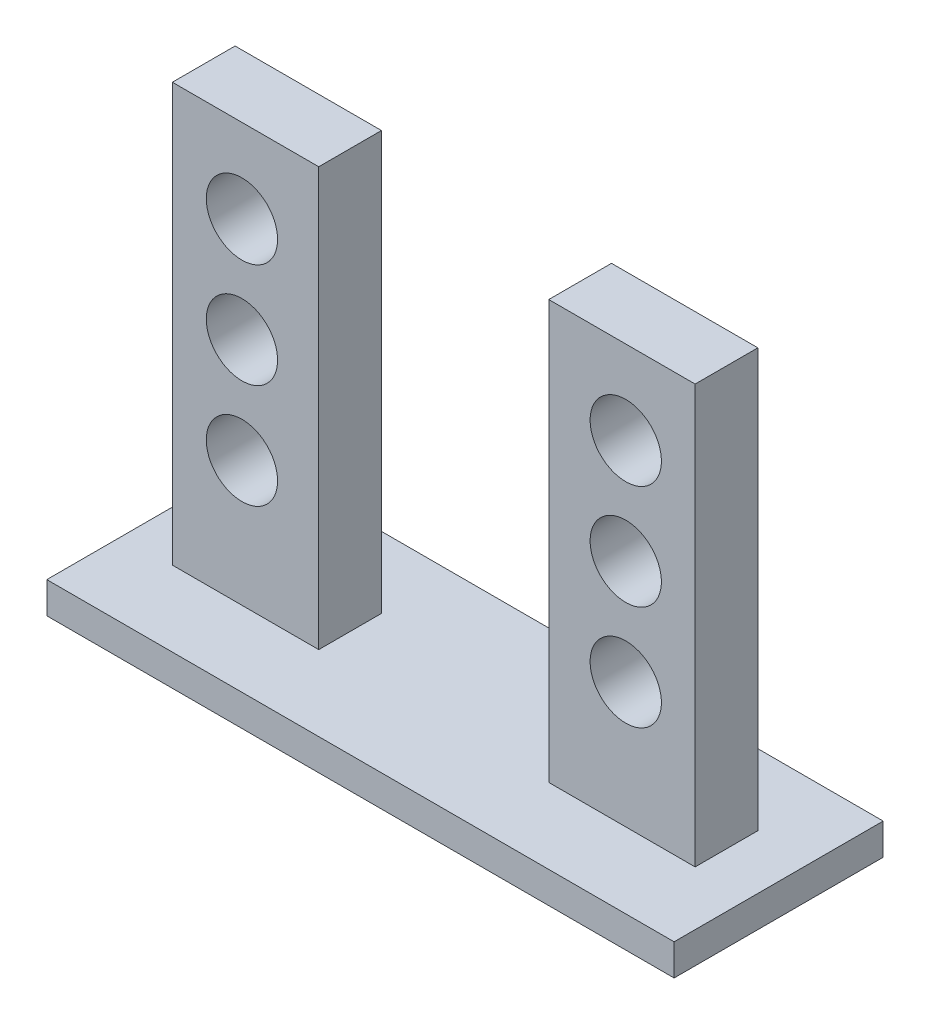
from build123d import *

# Parameters (mm, degrees)
BOSS_EXTRUDE1_DEPTH = 1.5
SKETCH3_W           = 7
SKETCH3_H           = 3
BOSS_EXTRUDE2_DEPTH = 20
SKETCH4_R           = 1.705
CUT_EXTRUDE1_DEPTH  = 5
LPATTERN1_COUNT     = 3
LPATTERN1_PITCH     = 5


with BuildPart() as part:
    # Sketch1 → Boss-Extrude1 (new body)
    with BuildSketch(Plane(origin=(0, 0, 0), x_dir=(1, 0, 0), z_dir=(0, 1, 0))):
        Polygon((-5.789473684, 5), (-15.789473684, 5), (-15.789473684, -5), (-5.789473684, -5), (4.210526316, -5), (14.210526316, -5), (14.210526316, 5), (4.210526316, 5), align=None)
    extrude(amount=-BOSS_EXTRUDE1_DEPTH)

    # Sketch3 → Boss-Extrude2 (add)
    with BuildSketch(Plane(origin=(0, 0, 0), x_dir=(1, 0, 0), z_dir=(0, 1, 0))):
        with Locations((-9.886735186, 0.10262718)):
            Rectangle(SKETCH3_W, SKETCH3_H)
        with Locations((8.113264814, 0.10262718)):
            Rectangle(SKETCH3_W, SKETCH3_H)
    extrude(amount=BOSS_EXTRUDE2_DEPTH)

    # Sketch4 → Cut-Extrude1 (cut, symmetric)
    with BuildSketch(Plane.XY):
        with Locations(Location((-10.0595209, 16, 0), (0, 0, 180))):
            Circle(SKETCH4_R)
        with Locations(Location((8.29517143, 16, 0), (0, 0, 180))):
            Circle(SKETCH4_R)
    cut_extrude1 = extrude(amount=CUT_EXTRUDE1_DEPTH, both=True, mode=Mode.SUBTRACT)

    # LPattern1: Cut-Extrude1 ×3
    with Locations(*[(0, -i * LPATTERN1_PITCH, 0) for i in range(1, LPATTERN1_COUNT)]):
        add(cut_extrude1, mode=Mode.SUBTRACT)


solid = part.part
